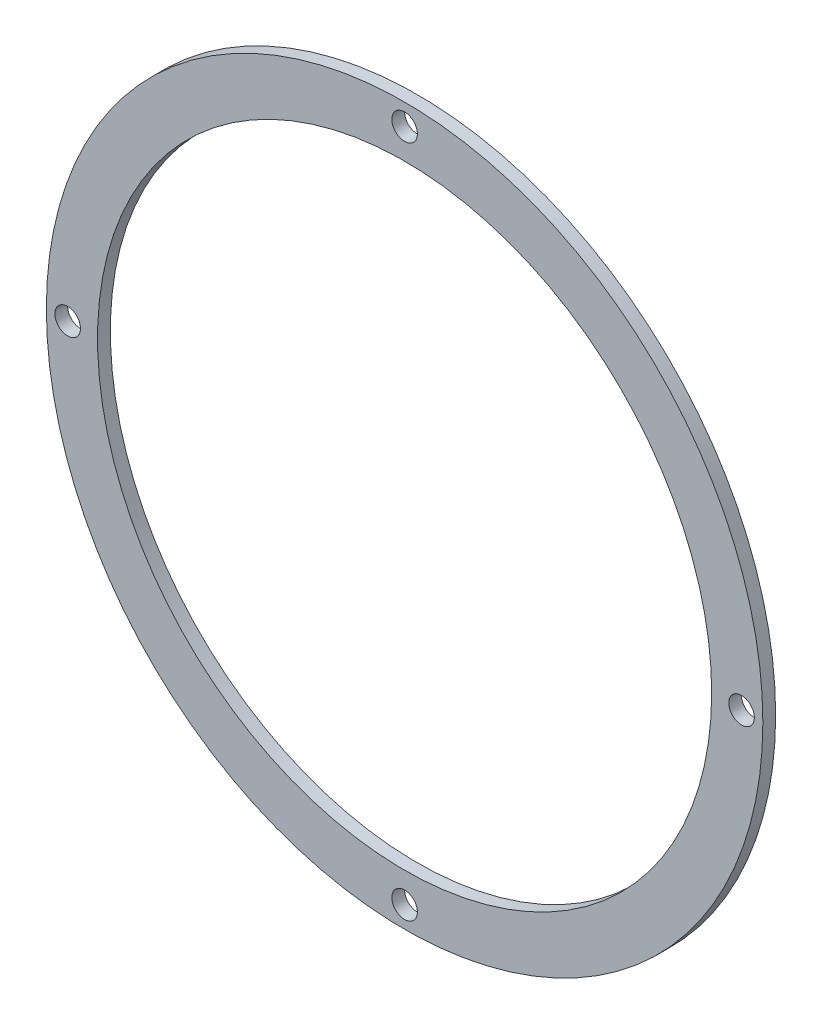
from build123d import *

# Parameters (mm, degrees)
SKETCH_1_R      = 84
SKETCH_1_R_2    = 72
SKETCH_1_R_3    = 3
EXTRUDE_1_DEPTH = 3


with BuildPart() as part:
    # 草图1 → 凸台-拉伸1 (new body)
    with BuildSketch(Plane.XY):
        Circle(SKETCH_1_R)
        Circle(SKETCH_1_R_2, mode=Mode.SUBTRACT)
        with Locations((0, 79)):
            Circle(SKETCH_1_R_3, mode=Mode.SUBTRACT)
        with Locations((79, 0)):
            Circle(SKETCH_1_R_3, mode=Mode.SUBTRACT)
        with Locations((0, -79)):
            Circle(SKETCH_1_R_3, mode=Mode.SUBTRACT)
        with Locations((-79, 0)):
            Circle(SKETCH_1_R_3, mode=Mode.SUBTRACT)
    extrude(amount=EXTRUDE_1_DEPTH)


solid = part.part
